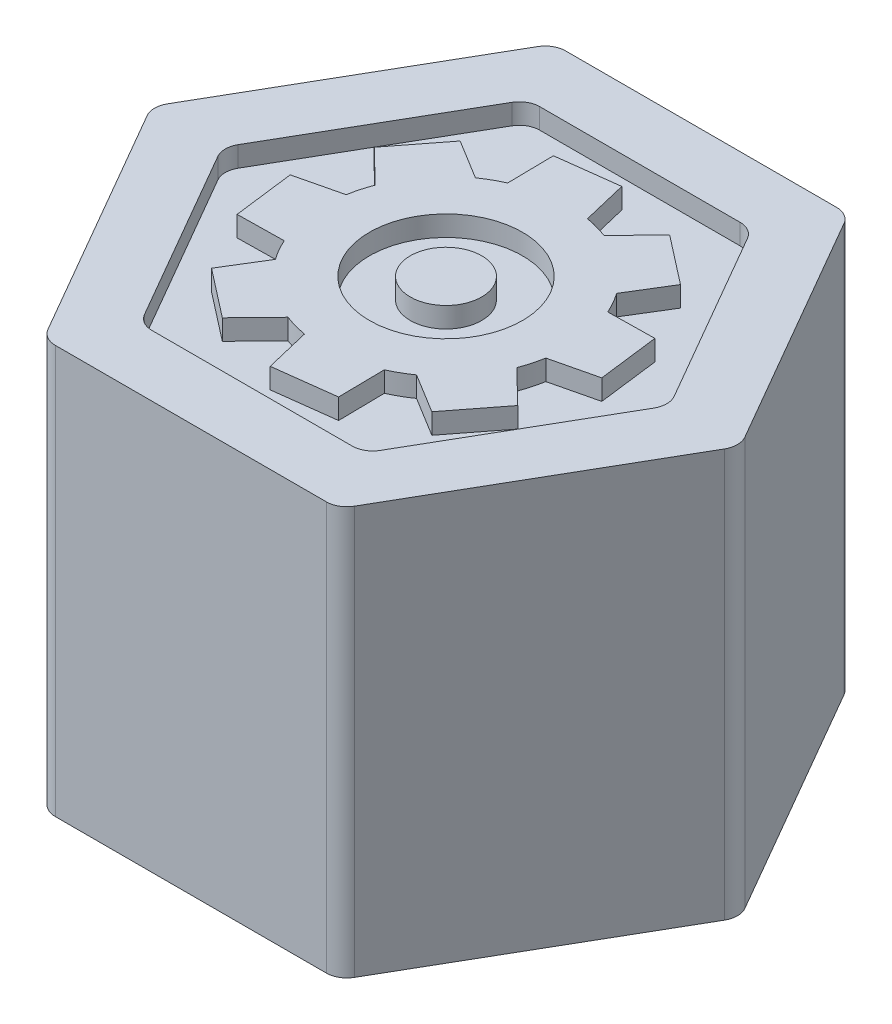
from build123d import *

# Parameters (mm, degrees)
EXTRUDE_1_DEPTH     = 20
CUT_EXTRUDE_1_DEPTH = 1
SKETCH_3_R          = 3.75
SKETCH_3_R_2        = 1.75
EXTRUDE_2_DEPTH     = 1
FILLET_1_R          = 1
CUT_EXTRUDE_2_DEPTH = 1


with BuildPart() as part:
    # 草图1 → 凸台-拉伸1 (new body)
    with BuildSketch(Plane(origin=(0, 0, 0), x_dir=(1, 0, 0), z_dir=(0, 1, 0))):
        Polygon((14.43375673, 0), (7.216878365, 12.5), (-7.216878365, 12.5), (-14.43375673, 0), (-7.216878365, -12.5), (7.216878365, -12.5), align=None)
    extrude(amount=EXTRUDE_1_DEPTH)

    # 草图2 → 切除-拉伸1 (cut)
    with BuildSketch(Plane(origin=(0, 20, 0), x_dir=(1, 0, 0), z_dir=(0, 1, 0))):
        Polygon((5.484827557, -9.5), (10.969655115, 0), (5.484827557, 9.5), (-5.484827557, 9.5), (-10.969655115, 0), (-5.484827557, -9.5), align=None)
    extrude(amount=-CUT_EXTRUDE_1_DEPTH, mode=Mode.SUBTRACT)

    # 草图3 → 凸台-拉伸2 (add)
    # profile 1 of 2: a face of its own
    with BuildSketch(Plane(origin=(0, 19, 0), x_dir=(1, 0, 0), z_dir=(0, 1, 0))):
        with BuildLine():
            Line((8.124640736, -0.490115197), (7.750329512, 2.486441724))
            Line((7.750329512, 2.486441724), (5.47592438, 2.452397232))
            ThreePointArc((5.47592438, 2.452397232), (5.213474627, 2.969794996), (4.902281736, 3.4594268))
            Line((4.902281736, 3.4594268), (6.091552339, 5.39842478))
            Line((6.091552339, 5.39842478), (3.72213075, 7.238490359))
            Line((3.72213075, 7.238490359), (2.137956549, 5.606169975))
            ThreePointArc((2.137956549, 5.606169975), (1.586521082, 5.786445442), (1.02025251, 5.912620808))
            Line((1.02025251, 5.912620808), (0.490115197, 8.124640736))
            Line((0.490115197, 8.124640736), (-2.486441724, 7.750329512))
            Line((-2.486441724, 7.750329512), (-2.452397232, 5.47592438))
            ThreePointArc((-2.452397232, 5.47592438), (-2.969794996, 5.213474627), (-3.4594268, 4.902281736))
            Line((-3.4594268, 4.902281736), (-5.39842478, 6.091552339))
            Line((-5.39842478, 6.091552339), (-7.238490359, 3.72213075))
            Line((-7.238490359, 3.72213075), (-5.606169975, 2.137956549))
            ThreePointArc((-5.606169975, 2.137956549), (-5.786445442, 1.586521082), (-5.912620808, 1.02025251))
            Line((-5.912620808, 1.02025251), (-8.124640736, 0.490115197))
            Line((-8.124640736, 0.490115197), (-7.750329512, -2.486441724))
            Line((-7.750329512, -2.486441724), (-5.47592438, -2.452397232))
            ThreePointArc((-5.47592438, -2.452397232), (-5.213474627, -2.969794996), (-4.902281736, -3.4594268))
            Line((-4.902281736, -3.4594268), (-6.091552339, -5.39842478))
            Line((-6.091552339, -5.39842478), (-3.72213075, -7.238490359))
            Line((-3.72213075, -7.238490359), (-2.137956549, -5.606169975))
            ThreePointArc((-2.137956549, -5.606169975), (-1.586521082, -5.786445442), (-1.02025251, -5.912620808))
            Line((-1.02025251, -5.912620808), (-0.490115197, -8.124640736))
            Line((-0.490115197, -8.124640736), (2.486441724, -7.750329512))
            Line((2.486441724, -7.750329512), (2.452397232, -5.47592438))
            ThreePointArc((2.452397232, -5.47592438), (2.969794996, -5.213474627), (3.4594268, -4.902281736))
            Line((3.4594268, -4.902281736), (5.39842478, -6.091552339))
            Line((5.39842478, -6.091552339), (7.238490359, -3.72213075))
            Line((7.238490359, -3.72213075), (5.606169975, -2.137956549))
            ThreePointArc((5.606169975, -2.137956549), (5.786445442, -1.586521082), (5.912620808, -1.02025251))
            Line((5.912620808, -1.02025251), (8.124640736, -0.490115197))
        make_face()
        with Locations(Location((0, 0, 0), (0, 0, 270))):
            Circle(SKETCH_3_R, mode=Mode.SUBTRACT)
    # profile 2 of 2: a face of its own
    with BuildSketch(Plane(origin=(0, 19, 0), x_dir=(1, 0, 0), z_dir=(0, 1, 0))):
        with Locations(Location((0, 0, 0), (0, 0, 270))):
            Circle(SKETCH_3_R_2)
    extrude(amount=EXTRUDE_2_DEPTH)

    # 圆角1
    fillet_1_edges = [part.edges().sort_by_distance(p)[0] for p in [
        (7.216878365, 10, 12.5),
        (-7.216878365, 10, 12.5),
        (-14.43375673, 10, 0),
        (-7.216878365, 10, -12.5),
        (7.216878365, 10, -12.5),
        (14.43375673, 10, 0),
        (5.484827557, 19.5, 9.5),
        (-5.484827557, 19.5, 9.5),
        (-10.969655115, 19.5, 0),
        (-5.484827557, 19.5, -9.5),
        (5.484827557, 19.5, -9.5),
        (10.969655115, 19.5, 0),
    ]]
    fillet(fillet_1_edges, radius=FILLET_1_R)

    # 草图5 → 切除-拉伸2 (cut)
    with BuildSketch(Plane(origin=(-10.825317547, 0, -6.25), x_dir=(-0.4999999999999999, 0, 0.8660254037844386), z_dir=(-0.8660254037844387, 0, -0.49999999999999994))):
        with BuildLine():
            Line((3.182453488, 16.969587549), (3.182453488, 14.764791287))
            Line((3.182453488, 14.764791287), (-0.912168142, 14.764791287))
            Line((-0.912168142, 14.764791287), (-0.912168142, 12.424655968))
            add(Edge.make_bspline(
                [(-0.912168142, 12.424655968), (-0.847309657, 12.498399491), (-0.720214162, 12.642905944), (-0.505577598, 12.829771532), (-0.281644119, 12.993696487), (-0.03802037, 13.120245746), (0.216657884, 13.221856292), (0.48430812, 13.297309113), (0.76720826, 13.338516205), (0.96030635, 13.344412753), (1.05886066, 13.347422261)],
                knots=[0, 0, 0, 0, 1.045137506, 2.048032268, 3.025244095, 3.994689253, 4.963425262, 5.942900511, 6.950087905, 8, 8, 8, 8], degree=3))
            add(Edge.make_bspline(
                [(1.05886066, 13.347422261), (1.16883757, 13.344864159), (1.382789631, 13.339887557), (1.693785994, 13.307073086), (1.983134795, 13.243970031), (2.252993321, 13.162283164), (2.500375895, 13.052039166), (2.730038976, 12.922999932), (2.933985745, 12.762421538), (3.123965679, 12.581868168), (3.288793274, 12.361712081), (3.431996368, 12.101261287), (3.547683834, 11.794691149), (3.645932383, 11.446555171), (3.720891941, 11.053767841), (3.772768776, 10.617140926), (3.808847597, 10.136794392), (3.811179356, 9.801612815), (3.812395277, 9.626828569)],
                knots=[0, 0, 0, 0, 0.985872992, 1.917944025, 2.797562931, 3.637028488, 4.440265023, 5.220874469, 5.991447987, 6.760933446, 7.563799771, 8.445720104, 9.41645382, 10.49401341, 11.685015475, 12.996358654, 14.433717056, 16, 16, 16, 16], degree=3))
            Line((3.812395277, 9.626828569), (3.812395277, 7.729621071))
            add(Edge.make_bspline(
                [(3.812395277, 7.729621071), (3.811636865, 7.615610244), (3.810174535, 7.39578083), (3.80705838, 7.077408436), (3.793560759, 6.782973949), (3.778578513, 6.511500745), (3.76367309, 6.263371536), (3.737287126, 6.038869904), (3.711892824, 5.837464832), (3.669454906, 5.601271022), (3.597733869, 5.326616934), (3.472868845, 5.012709117), (3.309162628, 4.711425167), (3.108564003, 4.423721493), (2.866599584, 4.157179392), (2.577446527, 3.92540628), (2.24645401, 3.7248973), (1.873113716, 3.557651353), (1.455891936, 3.427693886), (0.995726213, 3.335903519), (0.492669559, 3.279113398), (0.142814297, 3.272028018), (-0.038616051, 3.268353634)],
                knots=[0, 0, 0, 0, 0.989754807, 1.908390848, 2.7635747, 3.547977914, 4.268858805, 4.920711554, 5.509810583, 6.030765573, 7.003130656, 7.968352344, 8.956004724, 9.973318671, 11.006457242, 12.069562088, 13.178372901, 14.357538766, 15.611873537, 16.963616047, 18.425371121, 20, 20, 20, 20], degree=3))
            add(Edge.make_bspline(
                [(-0.038616051, 3.268353634), (-0.243948644, 3.274180091), (-0.644079256, 3.285534078), (-1.226293798, 3.369283972), (-1.771106092, 3.51227482), (-2.196157724, 3.678501355), (-2.511106829, 3.83980469), (-2.728441898, 3.974571457), (-2.926504503, 4.126800061), (-3.108892964, 4.2902182), (-3.271392556, 4.469966225), (-3.421915, 4.658960555), (-3.548207739, 4.867044262), (-3.661278956, 5.089487655), (-3.758939888, 5.334542356), (-3.837250577, 5.608986087), (-3.910253078, 5.912248249), (-3.964865943, 6.247990604), (-4.008619503, 6.61415961), (-4.040877856, 7.010590868), (-4.056594386, 7.437489802), (-4.060074578, 7.732071764), (-4.061877088, 7.884645808)],
                knots=[0, 0, 0, 0, 1.727950145, 3.367247941, 4.937991842, 6.459754912, 7.197724692, 7.914163588, 8.608713051, 9.29788901, 9.972208411, 10.646138941, 11.328189198, 12.016707826, 12.744892405, 13.544369189, 14.416825977, 15.369082158, 16.405235107, 17.52037283, 18.715716525, 20, 20, 20, 20], degree=3))
            Line((-4.061877088, 7.884645808), (-4.061877088, 8.622858842))
            Line((-4.061877088, 8.622858842), (-0.754682694, 8.622858842))
            Line((-0.754682694, 8.622858842), (-0.754682694, 7.766531722))
            add(Edge.make_bspline(
                [(-0.754682694, 7.766531722), (-0.753745858, 7.659902919), (-0.75193704, 7.454026853), (-0.751208911, 7.157043894), (-0.743002222, 6.883906615), (-0.733560957, 6.635339552), (-0.721369171, 6.411380043), (-0.706933178, 6.211159983), (-0.689454556, 6.034806531), (-0.672120944, 5.880501001), (-0.642961084, 5.747231672), (-0.601357722, 5.632643336), (-0.547313566, 5.534055691), (-0.477049795, 5.453064567), (-0.392137997, 5.391956317), (-0.296077191, 5.345048165), (-0.184835288, 5.322009644), (-0.106776695, 5.317852774), (-0.065683863, 5.315664449)],
                knots=[0, 0, 0, 0, 1.823732709, 3.521214749, 5.07892445, 6.496893277, 7.775393918, 8.9147992, 9.929598955, 10.806563962, 11.568882902, 12.256841855, 12.884990135, 13.481481553, 14.073502327, 14.663358483, 15.296344146, 16, 16, 16, 16], degree=3))
            add(Edge.make_bspline(
                [(-0.065683863, 5.315664449), (-0.027731598, 5.317411777), (0.046123876, 5.320812096), (0.149783373, 5.351069232), (0.243322788, 5.398874635), (0.343070554, 5.490110476), (0.439159872, 5.622616497), (0.479320906, 5.768787157), (0.480182252, 5.884957887), (0.487287538, 5.986529514), (0.487850586, 6.126071944), (0.490137715, 6.30324548), (0.496700441, 6.518097802), (0.496919244, 6.770787873), (0.503969738, 7.060282299), (0.504774487, 7.266182326), (0.505200884, 7.375278814)],
                knots=[0, 0, 0, 0, 0.670460052, 1.304721758, 1.895793995, 2.513210904, 3.681360763, 4.748587252, 5.126397419, 5.736946296, 6.550219692, 7.595791071, 8.873918375, 10.355072828, 12.068728984, 14, 14, 14, 14], degree=3))
            Line((0.505200884, 7.375278814), (0.505200884, 10.010699346))
            add(Edge.make_bspline(
                [(0.505200884, 10.010699346), (0.503380579, 10.125575768), (0.500045872, 10.336023509), (0.47546885, 10.622126346), (0.431657196, 10.849379296), (0.366944382, 11.02443971), (0.272609864, 11.14988358), (0.158217982, 11.242089048), (0.013291946, 11.290877165), (-0.089964803, 11.296922757), (-0.144426586, 11.300111446)],
                knots=[0, 0, 0, 0, 1.685864163, 3.088417099, 4.207402662, 5.076902269, 5.799120759, 6.485333904, 7.201103886, 8, 8, 8, 8], degree=3))
            add(Edge.make_bspline(
                [(-0.144426586, 11.300111446), (-0.179832609, 11.298921334), (-0.249105789, 11.296592836), (-0.348784063, 11.271685194), (-0.438878072, 11.228403245), (-0.543268285, 11.155689146), (-0.642858944, 11.044453729), (-0.714660126, 10.910993139), (-0.732507313, 10.774549614), (-0.748399256, 10.626376191), (-0.753089766, 10.428180796), (-0.75411592, 10.279715188), (-0.754682694, 10.197713315)],
                knots=[0, 0, 0, 0, 0.735055358, 1.438162732, 2.117072139, 2.803012647, 4.070557493, 5.191645157, 5.884125613, 6.912400264, 8.294628872, 10, 10, 10, 10], degree=3))
            Line((-0.754682694, 10.197713315), (-4.061877088, 10.197713315))
            Line((-4.061877088, 10.197713315), (-3.904391641, 16.969587549))
            Line((-3.904391641, 16.969587549), (3.182453488, 16.969587549))
        make_face()
    extrude(amount=-CUT_EXTRUDE_2_DEPTH, mode=Mode.SUBTRACT)


solid = part.part
